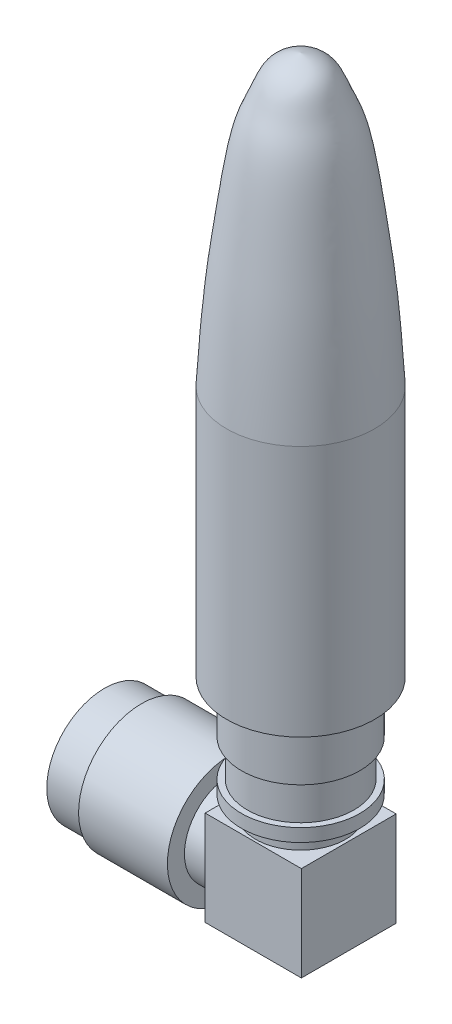
from build123d import *

# Parameters (mm, degrees)
SKETCH_2_W          = 6.5
SKETCH_2_H          = 6.4
EXTRUDE_1_DEPTH     = 6.4
SKETCH_5_R          = 2.7
CUT_EXTRUDE_1_DEPTH = 5


with BuildPart() as part:
    # 草图1 → 旋转1 (revolve)
    with BuildSketch(Plane.XY, mode=Mode.PRIVATE) as revolve_1_sk:
        with BuildLine():
            Line((0, 0), (-3.036670619, 0))
            Line((-3.036670619, 0), (-3.036670619, 1.125720416))
            Line((-3.036670619, 1.125720416), (-4, 1.125720416))
            Line((-4, 1.125720416), (-4, 2))
            Line((-4, 2), (-3.6, 2))
            Line((-3.6, 2), (-3.6, 4.5))
            Line((-3.6, 4.5), (-4, 4.5))
            Line((-4, 4.5), (-4, 8))
            Line((-4, 8), (-5, 8))
            Line((-5, 8), (-5, 25))
            add(Edge.make_bspline(
                [(-5, 25), (-4.722166372, 30.033496439), (-3.774780509, 37.406959566), (-3.370776113, 40.075486719), (-1.977019792, 43.14029628), (-1.896061892, 44.030808648), (0, 44.5)],
                knots=[0, 0, 0, 0, 0.132032401, 0.478362498, 0.569488384, 1, 1, 1, 1], degree=3))
            Line((0, 44.5), (0, 0))
        make_face()
    revolve(revolve_1_sk.sketch.rotate(Axis((0, -22.695068061, 0), (0, 1, 0)), 270), axis=Axis((0, -22.695068061, 0), (0, 1, 0)))

    # 草图2 → 凸台-拉伸1 (add)
    with BuildSketch(Plane.XZ):
        Rectangle(SKETCH_2_W, SKETCH_2_H)
    extrude(amount=EXTRUDE_1_DEPTH)

    # 草图4 → 旋转4 (revolve)
    with BuildSketch(Plane.XY):
        Polygon((-3.25, -0.1), (-4.75, -0.1), (-4.75, 1.05), (-10.75, 1.05), (-10.75, 0.7), (-13.25, 0.7), (-13.25, -3.2), (-3.25, -3.2), align=None)
    revolve(axis=Axis((-3.25, -3.2, 0), (-1, 0, 0)))

    # 草图5 → 切除-拉伸1 (cut)
    with BuildSketch(Plane.ZY.offset(13.25)):
        with Locations(Location((0, -3.2, 0), (0, 0, 270))):
            Circle(SKETCH_5_R)
    extrude(amount=-CUT_EXTRUDE_1_DEPTH, mode=Mode.SUBTRACT)


solid = part.part
